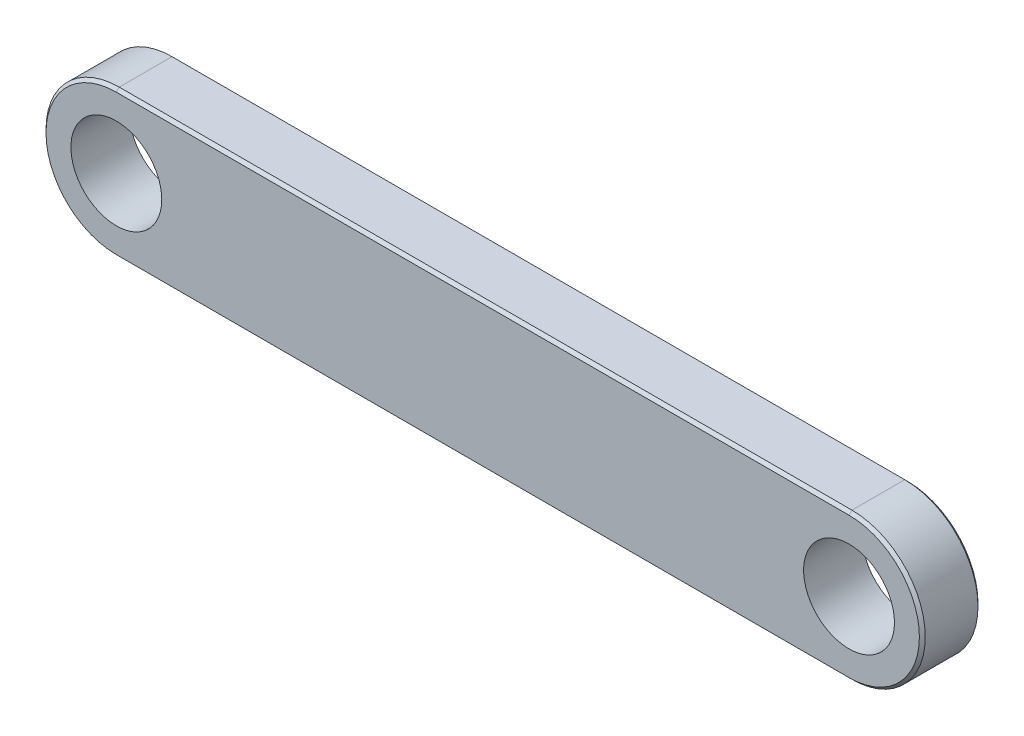
from build123d import *

# Parameters (mm, degrees)
SKETCH2_R           = 1.55
BOSS_EXTRUDE1_DEPTH = 2
CHAMFER1_SIZE       = 0.1


with BuildPart() as part:
    # Sketch2 → Boss-Extrude1 (new body)
    with BuildSketch(Plane.XY):
        with BuildLine():
            Line((-12.5, 2.5), (12.5, 2.5))
            ThreePointArc((12.5, 2.5), (15, 0), (12.5, -2.5))
            Line((12.5, -2.5), (-12.5, -2.5))
            ThreePointArc((-12.5, -2.5), (-15, 0), (-12.5, 2.5))
        make_face()
        with Locations((-12.5, 0)):
            Circle(SKETCH2_R, mode=Mode.SUBTRACT)
        with Locations((12.5, 0)):
            Circle(SKETCH2_R, mode=Mode.SUBTRACT)
    extrude(amount=BOSS_EXTRUDE1_DEPTH)

    # Chamfer1
    chamfer1_edges = [part.edges().sort_by_distance(p)[0] for p in [
        (15, 0, 2),
        (0, 2.5, 2),
        (-15, 0, 2),
        (0, 2.5, 0),
        (15, 0, 0),
        (0, -2.5, 0),
        (-15, 0, 0),
        (0, -2.5, 2),
    ]]
    chamfer(chamfer1_edges, length=CHAMFER1_SIZE)


solid = part.part
